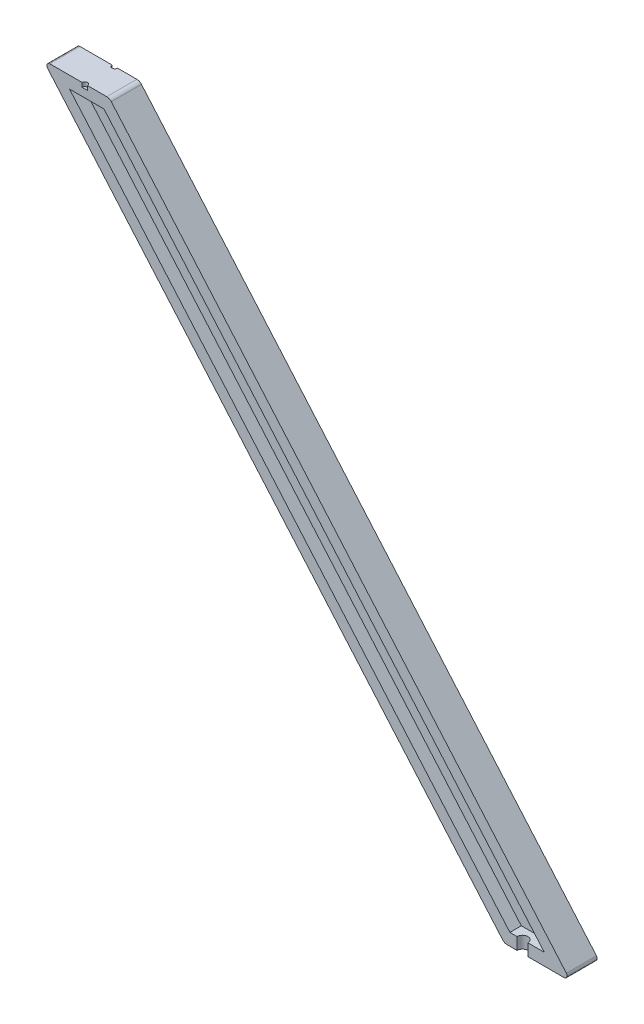
from build123d import *

# Parameters (mm, degrees)
BOSS_EXTRUDE1_DEPTH = 12.7
CUT_EXTRUDE1_DEPTH  = 4.826
CUT_EXTRUDE2_DEPTH  = 4.826
SKETCH5_R           = 1.143
CUT_EXTRUDE3_DEPTH  = 296.565841373
SKETCH6_R           = 2.286
CUT_EXTRUDE4_DEPTH  = 294.076685716


with BuildPart() as part:
    # Sketch1 → Boss-Extrude1 (new body)
    with BuildSketch(Plane.XY):
        with BuildLine():
            Line((-0.759864647, 0.880311666), (-192.659480012, 223.198155833))
            ThreePointArc((-192.659480012, 223.198155833), (-192.85282615, 224.556676606), (-191.698096292, 225.298))
            Line((-191.698096292, 225.298), (-167.694919671, 225.298))
            ThreePointArc((-167.694919671, 225.298), (-166.637566458, 225.067459717), (-165.772152229, 224.417688334))
            Line((-165.772152229, 224.417688334), (26.127463136, 2.099844167))
            ThreePointArc((26.127463136, 2.099844167), (26.320809274, 0.741323394), (25.166079416, 0))
            Line((25.166079416, 0), (1.162902795, 0))
            ThreePointArc((1.162902795, 0), (0.105549582, 0.230540283), (-0.759864647, 0.880311666))
        make_face()
    extrude(amount=BOSS_EXTRUDE1_DEPTH)

    # Sketch3 → Cut-Extrude1 (cut)
    with BuildSketch(Plane.XY.offset(12.7)):
        Polygon((-183.376334539, 220.218), (2.32580559, 5.08), (16.844317663, 5.08), (-168.857822466, 220.218), align=None)
    extrude(amount=-CUT_EXTRUDE1_DEPTH, mode=Mode.SUBTRACT)

    # Sketch4 → Cut-Extrude2 (cut)
    with BuildSketch(Plane(origin=(0, 0, 0), x_dir=(-1, 0, 0), z_dir=(0, 0, -1))):
        Polygon((183.376334539, 220.218), (168.857822466, 220.218), (-16.844317663, 5.08), (-2.32580559, 5.08), align=None)
    extrude(amount=-CUT_EXTRUDE2_DEPTH, mode=Mode.SUBTRACT)

    # Sketch5 → Cut-Extrude3 (cut, through all)
    with BuildSketch(Plane.XZ.offset(-223.52)):
        with Locations((-176.948152229, 0)):
            Circle(SKETCH5_R)
        with Locations((-176.948152229, 12.7)):
            Circle(SKETCH5_R)
    extrude(amount=-CUT_EXTRUDE3_DEPTH, mode=Mode.SUBTRACT)

    # Sketch6 → Cut-Extrude4 (cut, through all)
    with BuildSketch(Plane(origin=(0, 5.08, 0), x_dir=(1, 0, 0), z_dir=(0, 1, 0))):
        with Locations((7.622135353, -12.7)):
            Circle(SKETCH6_R)
        with Locations((7.622135353, 0)):
            Circle(SKETCH6_R)
    extrude(amount=-CUT_EXTRUDE4_DEPTH, mode=Mode.SUBTRACT)


solid = part.part
